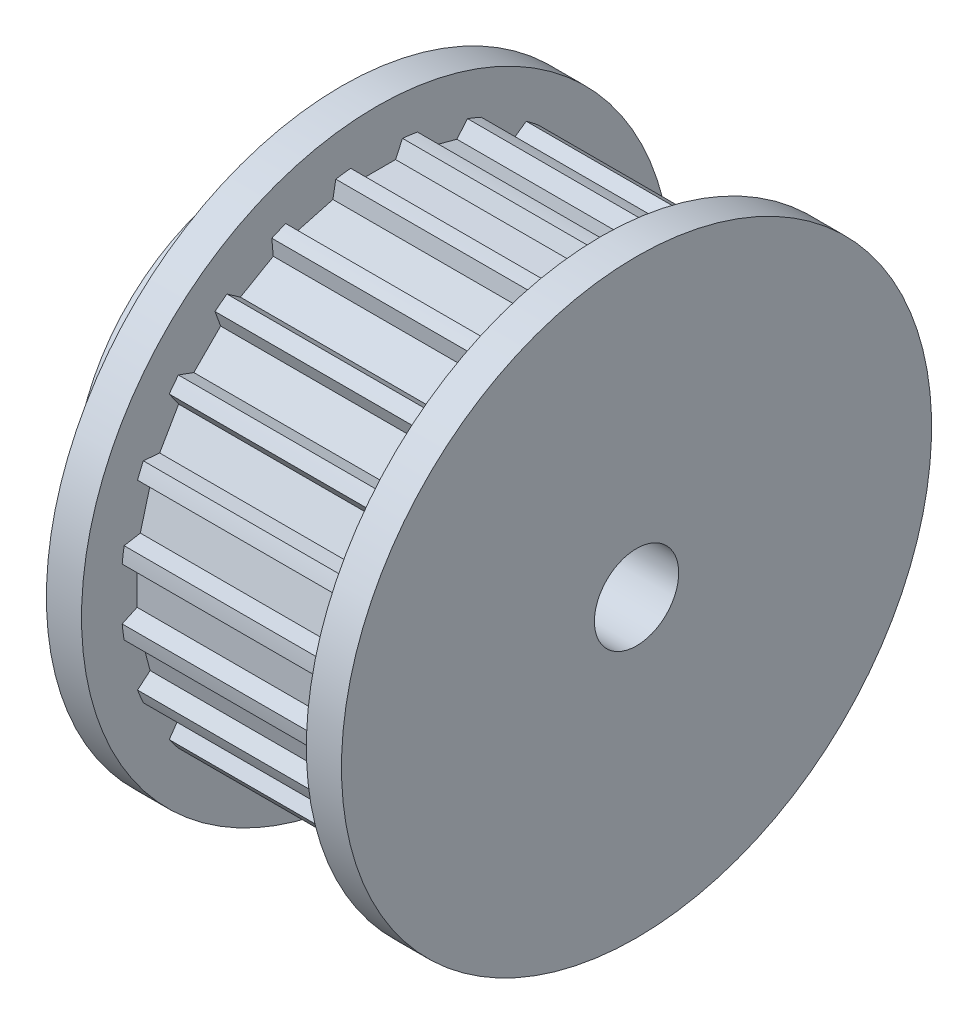
from build123d import *

# Parameters (mm, degrees)
CUT_EXTRUDE1_DEPTH = 16
CIRPATTERN1_COUNT  = 24


with BuildPart() as part:
    # Sketch1 → Revolve1 (revolve)
    with BuildSketch(Plane.XY, mode=Mode.PRIVATE) as revolve1_sk:
        Polygon((-13.5, 3), (13.5, 3), (13.5, 21), (11, 21), (11, 18.45), (11, 18.2), (-5, 18.2), (-5, 18.45), (-5, 21), (-7.5, 21), (-7.5, 13), (-13.5, 13), align=None)
    revolve(revolve1_sk.sketch.rotate(Axis((-13.5, 0, 0), (1, 0, 0)), 180), axis=Axis((-13.5, 0, 0), (1, 0, 0)))

    # Sketch3 → Cut-Extrude1 (cut)
    with BuildSketch(Plane(origin=(-5, 0, 0), x_dir=(0, 0, -1), z_dir=(1, 0, 0))):
        with BuildLine():
            Line((-1.844146703, 18.106328257), (-1.35, 17.046627232))
            Line((-1.35, 17.046627232), (1.35, 17.046627232))
            Line((1.35, 17.046627232), (1.844146703, 18.106328257))
            ThreePointArc((1.844146703, 18.106328257), (0, 18.2), (-1.844146703, 18.106328257))
        make_face()
    cut_extrude1 = extrude(amount=CUT_EXTRUDE1_DEPTH, mode=Mode.SUBTRACT)

    # CirPattern1: Cut-Extrude1 ×24 about axis
    cirpattern1_axis = Axis((0, 0, 0), (1, 0, 0))
    for i in range(1, CIRPATTERN1_COUNT):
        add(cut_extrude1.rotate(cirpattern1_axis, i * 360 / CIRPATTERN1_COUNT), mode=Mode.SUBTRACT)


solid = part.part
